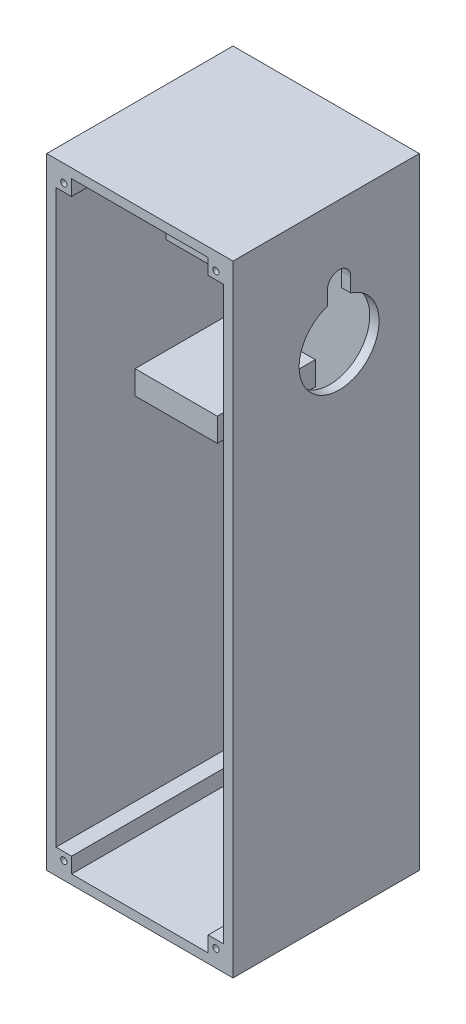
from build123d import *

# Parameters (mm, degrees)
SZKIC1_W                    = 60
SZKIC1_H                    = 60
DODANIE_WYCI_GNI_CIE1_DEPTH = 200
SKORUPA1_T                  = -3
SZKIC2_W                    = 5
SZKIC2_H                    = 5
SZKIC2_R                    = 1
DODANIE_WYCI_GNI_CIE2_DEPTH = 57
SZKIC4_W                    = 5
SZKIC4_H                    = 5
SZKIC4_R                    = 1
DODANIE_WYCI_GNI_CIE3_DEPTH = 57
SZKIC5_W                    = 5
SZKIC5_H                    = 5
SZKIC5_R                    = 1
DODANIE_WYCI_GNI_CIE4_DEPTH = 57
SZKIC6_W                    = 5
SZKIC6_H                    = 5
SZKIC6_R                    = 1
DODANIE_WYCI_GNI_CIE6_DEPTH = 57
SZKIC9_R                    = 12.875
WYTNIJ_WYCI_GNI_CIE1_DEPTH  = 3
SZKIC10_W                   = 31.55
SZKIC10_H                   = 7.6
DODANIE_WYCI_GNI_CIE7_DEPTH = 26.5
SZKIC13_R                   = 1.5
WYTNIJ_WYCI_GNI_CIE4_DEPTH  = 5
WYTNIJ_WYCI_GNI_CIE7_DEPTH  = 10
SZKIC14_R                   = 1.5
WYTNIJ_WYCI_GNI_CIE8_DEPTH  = 5
WYTNIJ_WYCI_GNI_CIE10_DEPTH = 10


with BuildPart() as part:
    # Szkic1 → Dodanie-wyciągnięcie1 (new body)
    with BuildSketch(Plane(origin=(0, 0, 0), x_dir=(1, 0, 0), z_dir=(0, 1, 0))):
        with Locations((30, 30)):
            Rectangle(SZKIC1_W, SZKIC1_H)
    extrude(amount=DODANIE_WYCI_GNI_CIE1_DEPTH)

    # Skorupa1
    skorupa1_openings = [part.faces().sort_by_distance(p)[0] for p in [
        (30, 100, 0),
    ]]
    offset(amount=SKORUPA1_T, openings=skorupa1_openings, kind=Kind.INTERSECTION)

    # Szkic2 → Dodanie-wyciągnięcie2 (add)
    with BuildSketch(Plane.XY.offset(-57)):
        with Locations((5.5, 194.5)):
            Rectangle(SZKIC2_W, SZKIC2_H)
        with Locations(Location((5.5, 194.5, 0), (0, 0, 180))):
            Circle(SZKIC2_R, mode=Mode.SUBTRACT)
    extrude(amount=DODANIE_WYCI_GNI_CIE2_DEPTH)

    # Szkic4 → Dodanie-wyciągnięcie3 (add)
    with BuildSketch(Plane.XY):
        with Locations((54.5, 194.5)):
            Rectangle(SZKIC4_W, SZKIC4_H)
        with Locations((54.5, 194.5)):
            Circle(SZKIC4_R, mode=Mode.SUBTRACT)
    extrude(amount=-DODANIE_WYCI_GNI_CIE3_DEPTH)

    # Szkic5 → Dodanie-wyciągnięcie4 (add)
    with BuildSketch(Plane.XY.offset(-57)):
        with Locations((5.5, 5.5)):
            Rectangle(SZKIC5_W, SZKIC5_H)
        with Locations(Location((5.5, 5.5, 0), (0, 0, 180))):
            Circle(SZKIC5_R, mode=Mode.SUBTRACT)
    extrude(amount=DODANIE_WYCI_GNI_CIE4_DEPTH)

    # Szkic6 → Dodanie-wyciągnięcie6 (add)
    with BuildSketch(Plane.XY.offset(-57)):
        with Locations((54.5, 5.5)):
            Rectangle(SZKIC6_W, SZKIC6_H)
        with Locations(Location((54.5, 5.5, 0), (0, 0, 180))):
            Circle(SZKIC6_R, mode=Mode.SUBTRACT)
    extrude(amount=DODANIE_WYCI_GNI_CIE6_DEPTH)

    # Szkic9 → Wytnij-wyciągnięcie1 (cut)
    with BuildSketch(Plane(origin=(60, 0, 0), x_dir=(0, 0, -1), z_dir=(1, 0, 0))):
        with Locations((34.18, 159.82)):
            Circle(SZKIC9_R)
    extrude(amount=-WYTNIJ_WYCI_GNI_CIE1_DEPTH, mode=Mode.SUBTRACT)

    # Szkic10 → Dodanie-wyciągnięcie7 (add)
    with BuildSketch(Plane(origin=(3, 0, 0), x_dir=(0, 0, -1), z_dir=(1, 0, 0))):
        with Locations((41.225, 173.56)):
            Rectangle(SZKIC10_W, SZKIC10_H)
        with Locations((41.225, 124.96)):
            Rectangle(SZKIC10_W, SZKIC10_H)
    extrude(amount=DODANIE_WYCI_GNI_CIE7_DEPTH)

    # Szkic13 → Wytnij-wyciągnięcie4 (cut)
    with BuildSketch(Plane(origin=(29.5, 0, 0), x_dir=(0, 0, -1), z_dir=(1, 0, 0))):
        with Locations((39.21, 174.36)):
            Circle(SZKIC13_R)
        with Locations((29.42, 174.36)):
            Circle(SZKIC13_R)
    extrude(amount=-WYTNIJ_WYCI_GNI_CIE4_DEPTH, mode=Mode.SUBTRACT)

    # Szkic15 → Wytnij-wyciągnięcie7 (cut)
    with BuildSketch(Plane(origin=(0, 177.36, 0), x_dir=(1, 0, 0), z_dir=(0, 1, 0))):
        Polygon((13, 25.45), (3, 25.45), (3, 49.45), align=None)
    extrude(amount=-WYTNIJ_WYCI_GNI_CIE7_DEPTH, mode=Mode.SUBTRACT)

    # Szkic14 → Wytnij-wyciągnięcie8 (cut)
    with BuildSketch(Plane(origin=(29.5, 0, 0), x_dir=(0, 0, -1), z_dir=(1, 0, 0))):
        with Locations((39.21, 124.16)):
            Circle(SZKIC14_R)
        with Locations((29.42, 124.16)):
            Circle(SZKIC14_R)
    extrude(amount=-WYTNIJ_WYCI_GNI_CIE8_DEPTH, mode=Mode.SUBTRACT)

    # Szkic17 → Wytnij-wyciągnięcie10 (cut)
    with BuildSketch(Plane(origin=(60, 0, 0), x_dir=(0, 0, -1), z_dir=(1, 0, 0))):
        with BuildLine():
            Line((30.43, 172.445), (30.43, 176.755))
            ThreePointArc((30.43, 176.755), (34.18, 180.505), (37.93, 176.755))
            Line((37.93, 176.755), (37.93, 172.445))
            Line((37.93, 172.445), (37.93, 172.13678225))
            Line((37.93, 172.13678225), (30.43, 172.13678225))
            Line((30.43, 172.13678225), (30.43, 172.445))
        make_face()
    extrude(amount=-WYTNIJ_WYCI_GNI_CIE10_DEPTH, mode=Mode.SUBTRACT)


solid = part.part
